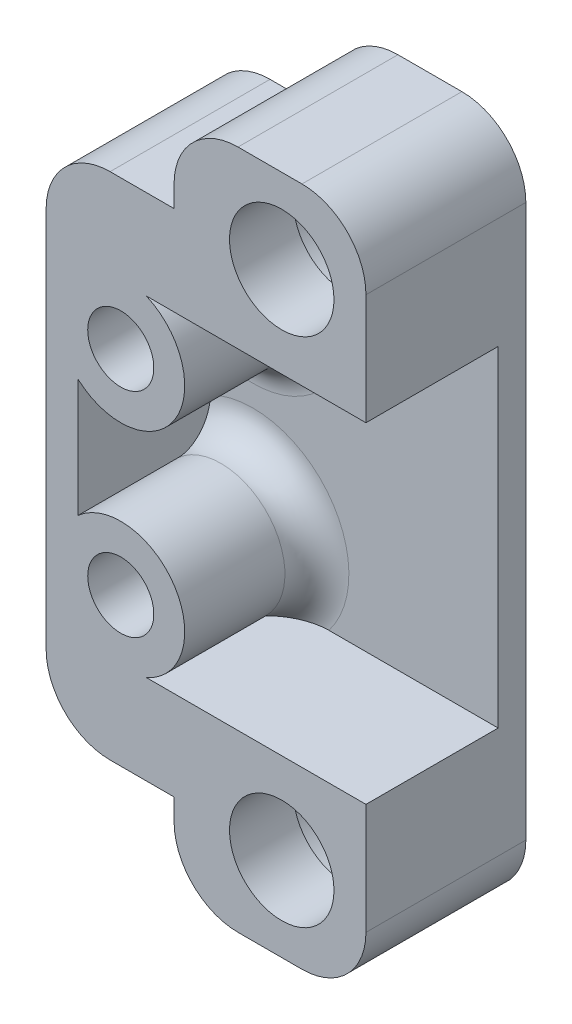
from build123d import *

# Parameters (mm, degrees)
SKETCH1_W                       = 20.480821918
SKETCH1_H                       = 31.9
SKETCH1_R                       = 2.45
BOSS_EXTRUDE1_DEPTH             = 7.5
SKETCH2_W                       = 18.980821918
SKETCH2_H                       = 9.35
CUT_EXTRUDE1_DEPTH              = 6.2
CUT_EXTRUDE2_REACH              = 22.384
SKETCH5_W                       = 5.480821918
SKETCH5_H                       = 31.9
SKETCH3_R                       = 3
SKETCH3_R_2                     = 1.55
BOSS_EXTRUDE4_DEPTH             = 6.2
SKETCH6_W                       = 1.5
SKETCH6_H                       = 15.5
CUT_EXTRUDE3_DEPTH              = 6.2
SKETCH7_W                       = 1.5
SKETCH7_H                       = 18.7
BOSS_EXTRUDE5_DEPTH             = 6.2
FILLET1_R                       = 3
SKETCH8_W                       = 6
SKETCH8_H                       = 4
CUT_EXTRUDE4_DEPTH              = 7.5
FILLET2_R                       = 3
BOSS_EXTRUDE6_REACH             = 21.943
BOSS_EXTRUDE6_DIRECTION_2_REACH = 21.943
SKETCH10_R                      = 3.25
CUT_EXTRUDE6_DEPTH              = 4.5
FILLET3_R                       = 1.5


with BuildPart() as part:
    # Sketch1 → Boss-Extrude1 (new body)
    with BuildSketch(Plane.XY):
        Rectangle(SKETCH1_W, SKETCH1_H)
        with Locations((6.290410959, 12)):
            Circle(SKETCH1_R, mode=Mode.SUBTRACT)
        with Locations((6.290410959, -12)):
            Circle(SKETCH1_R, mode=Mode.SUBTRACT)
    extrude(amount=BOSS_EXTRUDE1_DEPTH)

    # Sketch2 → Cut-Extrude1 (cut)
    with BuildSketch(Plane.XY.offset(7.5)):
        with Locations((-0.75, 4.675)):
            Rectangle(SKETCH2_W, SKETCH2_H)
        with Locations((-0.75, -4.675)):
            Rectangle(SKETCH2_W, SKETCH2_H)
    extrude(amount=-CUT_EXTRUDE1_DEPTH, mode=Mode.SUBTRACT)

    # Cut-Extrude2: up to this face of the body (flat: up to its plane)
    cut_extrude2_end = Plane(part.part.faces().sort_by_distance((-0.385368256, 0, 0))[0])
    # Sketch5 → Cut-Extrude2 (cut, up to the picked face)
    with BuildSketch(Plane.XY.offset(7.5), mode=Mode.PRIVATE) as cut_extrude2_sk1:
        with Locations((-7.5, 0)):
            Rectangle(SKETCH5_W, SKETCH5_H)
    cut_extrude2_tool1 = split(extrude(cut_extrude2_sk1.sketch, amount=-CUT_EXTRUDE2_REACH, mode=Mode.PRIVATE), bisect_by=cut_extrude2_end, keep=Keep.BOTH, mode=Mode.PRIVATE)
    add(cut_extrude2_tool1.solids().sort_by(Axis((-7.5, 0, 7.5), (0, 0, -1)))[0], mode=Mode.SUBTRACT)

    # Sketch3 → Boss-Extrude4 (add)
    # profile 1 of 2: a face of its own
    with BuildSketch(Plane.XY.offset(1.3)):
        with Locations(Location((-1.259589041, 5, 0), (0, 0, 180))):
            Circle(SKETCH3_R)
        with Locations(Location((-1.259589041, 5, 0), (0, 0, 180))):
            Circle(SKETCH3_R_2, mode=Mode.SUBTRACT)
    # profile 2 of 2: a face of its own
    with BuildSketch(Plane.XY.offset(1.3)):
        with Locations(Location((-1.259589041, -5, 0), (0, 0, 180))):
            Circle(SKETCH3_R)
        with Locations(Location((-1.259589041, -5, 0), (0, 0, 180))):
            Circle(SKETCH3_R_2, mode=Mode.SUBTRACT)
    extrude(amount=BOSS_EXTRUDE4_DEPTH)

    # Sketch6 → Cut-Extrude3 (cut)
    with BuildSketch(Plane.XY.offset(7.5)):
        with Locations((9.490410959, 0)):
            Rectangle(SKETCH6_W, SKETCH6_H)
    extrude(amount=-CUT_EXTRUDE3_DEPTH, mode=Mode.SUBTRACT)

    # Sketch7 → Boss-Extrude5 (add)
    with BuildSketch(Plane.XY.offset(1.3)):
        with Locations((-4.009589041, 0)):
            Rectangle(SKETCH7_W, SKETCH7_H)
    extrude(amount=BOSS_EXTRUDE5_DEPTH)

    # Fillet1
    fillet1_edges = [part.edges().sort_by_distance(p)[0] for p in [
        (10.240410959, 15.95, 3.75),
        (10.240410959, -15.95, 3.75),
    ]]
    fillet(fillet1_edges, radius=FILLET1_R)

    # Sketch8 → Cut-Extrude4 (cut)
    with BuildSketch(Plane.XY.offset(7.5)):
        with Locations((-1.759589041, 13.95)):
            Rectangle(SKETCH8_W, SKETCH8_H)
        with Locations((-1.759589041, -13.95)):
            Rectangle(SKETCH8_W, SKETCH8_H)
    extrude(amount=-CUT_EXTRUDE4_DEPTH, mode=Mode.SUBTRACT)

    # Fillet2
    fillet2_edges = [part.edges().sort_by_distance(p)[0] for p in [
        (1.240410959, 15.95, 3.75),
        (-4.759589041, 11.95, 3.75),
        (1.240410959, -15.95, 3.75),
        (-4.759589041, -11.95, 3.75),
    ]]
    fillet(fillet2_edges, radius=FILLET2_R)

    # Boss-Extrude6: up to this face of the body (flat: up to its plane)
    boss_extrude6_end = Plane(part.part.faces().sort_by_distance((5.740410959, -15.597493262, 7.5))[0])
    # Sketch11 → Boss-Extrude6 (add, up to the picked face)
    with BuildSketch(Plane.XY.offset(1.3), mode=Mode.PRIVATE) as boss_extrude6_sk1:
        with BuildLine():
            Line((-3.259589041, 7.236067977), (-3.259589041, 7.75))
            Line((-3.259589041, 7.75), (-3.259589041, 9.35))
            Line((-3.259589041, 9.35), (8.740410959, 9.35))
            Line((8.740410959, 9.35), (8.740410959, 7.75))
            Line((8.740410959, 7.75), (-0.06063116, 7.75))
            ThreePointArc((-0.06063116, 7.75), (-1.735455251, 7.962018121), (-3.259589041, 7.236067977))
        make_face()
    boss_extrude6_tool1 = split(extrude(boss_extrude6_sk1.sketch, amount=BOSS_EXTRUDE6_REACH, mode=Mode.PRIVATE), bisect_by=boss_extrude6_end, keep=Keep.BOTH, mode=Mode.PRIVATE)
    # Sketch11 → Boss-Extrude6 (add, up to the picked face)
    with BuildSketch(Plane.XY.offset(1.3), mode=Mode.PRIVATE) as boss_extrude6_sk2:
        with BuildLine():
            Line((-3.259589041, -7.75), (-3.259589041, -9.35))
            Line((-3.259589041, -9.35), (8.740410959, -9.35))
            Line((8.740410959, -9.35), (8.740410959, -7.75))
            Line((8.740410959, -7.75), (-0.06063116, -7.75))
            ThreePointArc((-0.06063116, -7.75), (-1.735455251, -7.962018121), (-3.259589041, -7.236067977))
            Line((-3.259589041, -7.236067977), (-3.259589041, -7.75))
        make_face()
    boss_extrude6_tool2 = split(extrude(boss_extrude6_sk2.sketch, amount=BOSS_EXTRUDE6_REACH, mode=Mode.PRIVATE), bisect_by=boss_extrude6_end, keep=Keep.BOTH, mode=Mode.PRIVATE)
    add(boss_extrude6_tool1.solids().sort_by(Axis((2.770321, 8.555653, 1.3), (0, 0, 1)))[0])
    add(boss_extrude6_tool2.solids().sort_by(Axis((2.770321, -8.555653, 1.3), (0, 0, 1)))[0])

    # Boss-Extrude6 direction 2: up to this face of the body (flat: up to its plane)
    boss_extrude6_direction_2_end = Plane(part.part.faces().sort_by_distance((2.964227546, 0, 0))[0])
    # Sketch11 → Boss-Extrude6 direction 2 (add, up to the picked face)
    with BuildSketch(Plane.XY.offset(1.3), mode=Mode.PRIVATE) as boss_extrude6_direction_2_sk1:
        with BuildLine():
            Line((-3.259589041, 7.236067977), (-3.259589041, 7.75))
            Line((-3.259589041, 7.75), (-3.259589041, 9.35))
            Line((-3.259589041, 9.35), (8.740410959, 9.35))
            Line((8.740410959, 9.35), (8.740410959, 7.75))
            Line((8.740410959, 7.75), (-0.06063116, 7.75))
            ThreePointArc((-0.06063116, 7.75), (-1.735455251, 7.962018121), (-3.259589041, 7.236067977))
        make_face()
    boss_extrude6_direction_2_tool1 = split(extrude(boss_extrude6_direction_2_sk1.sketch, amount=-BOSS_EXTRUDE6_DIRECTION_2_REACH, mode=Mode.PRIVATE), bisect_by=boss_extrude6_direction_2_end, keep=Keep.BOTH, mode=Mode.PRIVATE)
    # Sketch11 → Boss-Extrude6 direction 2 (add, up to the picked face)
    with BuildSketch(Plane.XY.offset(1.3), mode=Mode.PRIVATE) as boss_extrude6_direction_2_sk2:
        with BuildLine():
            Line((-3.259589041, -7.75), (-3.259589041, -9.35))
            Line((-3.259589041, -9.35), (8.740410959, -9.35))
            Line((8.740410959, -9.35), (8.740410959, -7.75))
            Line((8.740410959, -7.75), (-0.06063116, -7.75))
            ThreePointArc((-0.06063116, -7.75), (-1.735455251, -7.962018121), (-3.259589041, -7.236067977))
            Line((-3.259589041, -7.236067977), (-3.259589041, -7.75))
        make_face()
    boss_extrude6_direction_2_tool2 = split(extrude(boss_extrude6_direction_2_sk2.sketch, amount=-BOSS_EXTRUDE6_DIRECTION_2_REACH, mode=Mode.PRIVATE), bisect_by=boss_extrude6_direction_2_end, keep=Keep.BOTH, mode=Mode.PRIVATE)
    add(boss_extrude6_direction_2_tool1.solids().sort_by(Axis((2.770321, 8.555653, 1.3), (0, 0, -1)))[0])
    add(boss_extrude6_direction_2_tool2.solids().sort_by(Axis((2.770321, -8.555653, 1.3), (0, 0, -1)))[0])

    # Sketch10 → Cut-Extrude6 (cut)
    with BuildSketch(Plane(origin=(0, 0, 0), x_dir=(-1, 0, 0), z_dir=(0, 0, -1))):
        with Locations((-6.290410959, 12)):
            Circle(SKETCH10_R)
        with Locations((-6.290410959, -12)):
            Circle(SKETCH10_R)
    extrude(amount=-CUT_EXTRUDE6_DEPTH, mode=Mode.SUBTRACT)

    # Fillet3
    fillet3_edges = [part.edges().sort_by_distance(p)[0] for p in [
        (1.265413056, 3.380010984, 1.3),
        (1.265413056, -3.380010984, 1.3),
    ]]
    fillet(fillet3_edges, radius=FILLET3_R)


solid = part.part
